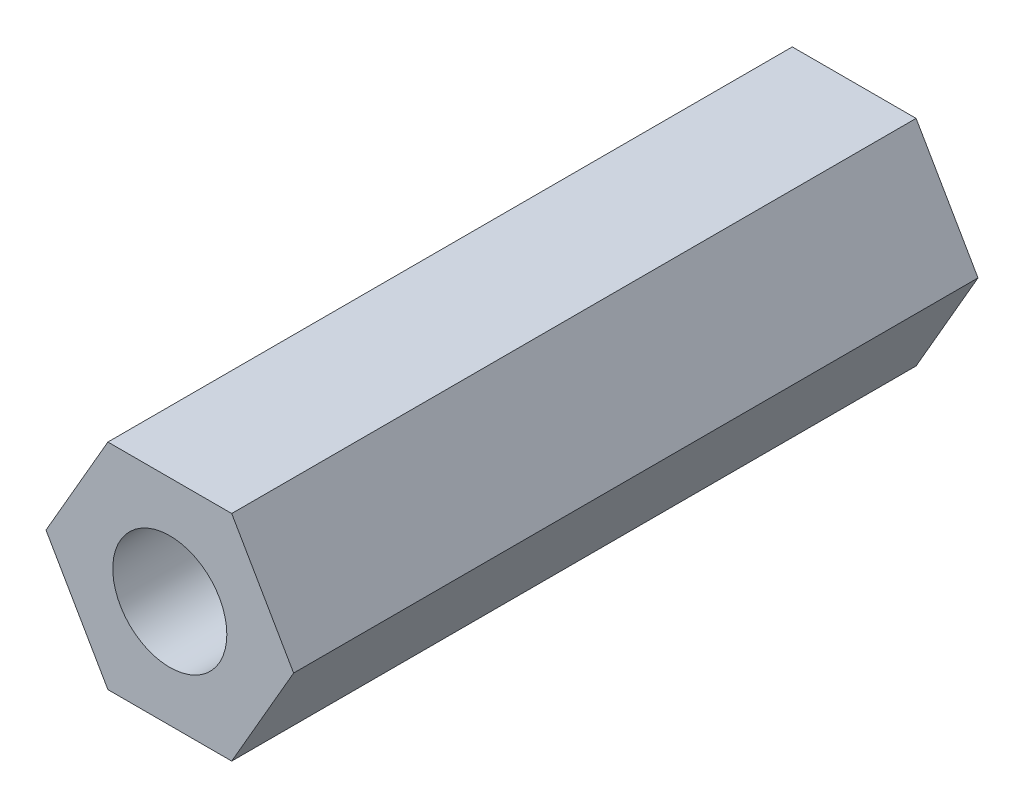
from build123d import *

# Parameters (mm, degrees)
EXTRUDE_1_DEPTH = 7.5


with BuildPart() as part:
    # 草图1 → 凸台-拉伸1 (new, symmetric)
    with BuildSketch(Plane.XY):
        Polygon((1.356773133, 2.35), (-1.356773133, 2.35), (-2.713546265, 0), (-1.356773133, -2.35), (1.356773133, -2.35), (2.713546265, 0), align=None)
    extrude(amount=EXTRUDE_1_DEPTH, both=True)

    # 草图3 → Hole Wizard 385 (revolve, cut)
    with BuildSketch(Plane(origin=(0, 0, 7.5), x_dir=(0, -1, 0), z_dir=(1, 0, 0))):
        Polygon((0, 0), (0, 8.751075774), (1.25, 8), (1.25, 0), align=None)
    hole_wizard_385 = revolve(axis=Axis((0, 0, 13.85), (0, 0, -1)), mode=Mode.SUBTRACT)

    # 镜向1: Hole Wizard 385 across plane
    add(hole_wizard_385.mirror(Plane.XY), mode=Mode.SUBTRACT)


solid = part.part
